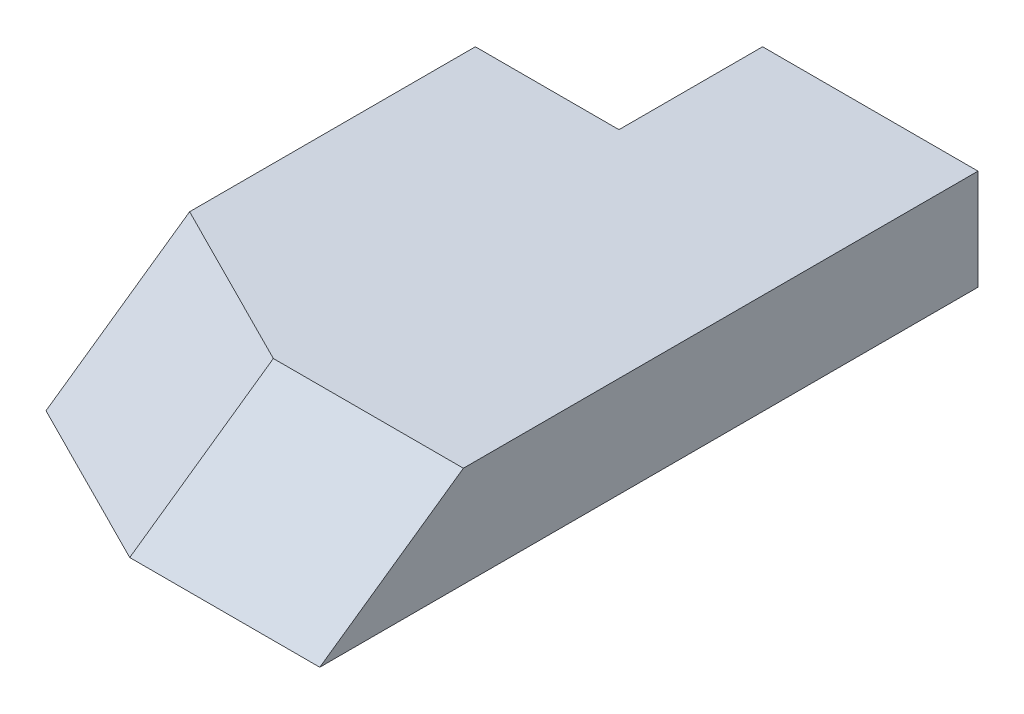
from build123d import *

# Parameters (mm, degrees)
BOSS_EXTRUDE1_DEPTH = 15
CUT_EXTRUDE1_DEPTH  = 9
SKETCH6_W           = 12
SKETCH6_H           = 12
CUT_EXTRUDE2_DEPTH  = 10


with BuildPart() as part:
    # Sketch1 → Boss-Extrude1 (new, symmetric)
    with BuildSketch(Plane(origin=(0, 0, 0), x_dir=(0, 0, -1), z_dir=(1, 0, 0))):
        Polygon((-28, -7), (15, -7), (15, -15.402490459), (-40, -15.402490459), align=None)
    extrude(amount=BOSS_EXTRUDE1_DEPTH, both=True)

    # Sketch5 → Cut-Extrude1 (cut)
    with BuildSketch(Plane(origin=(-2.825070642, 7.997590477, 5.599973139), x_dir=(0.9605940806562516, 0.22768745094625853, 0.1594284695083218), z_dir=(-0.27795505429506184, 0.7868726049014764, 0.5509741295627175))):
        Polygon((-26.918818093, -7.622217502), (-29.186447749, -42.35271731), (-0.242767458, -61.681792103), (30.96854249, -46.280367087), (33.236172147, -11.549867279), (4.292491855, 7.779207513), align=None)
    extrude(amount=CUT_EXTRUDE1_DEPTH, mode=Mode.SUBTRACT)

    # Sketch6 → Cut-Extrude2 (cut)
    with BuildSketch(Plane.XZ.offset(15.402490459)):
        with Locations((-9, -9)):
            Rectangle(SKETCH6_W, SKETCH6_H)
    extrude(amount=-CUT_EXTRUDE2_DEPTH, mode=Mode.SUBTRACT)


solid = part.part
